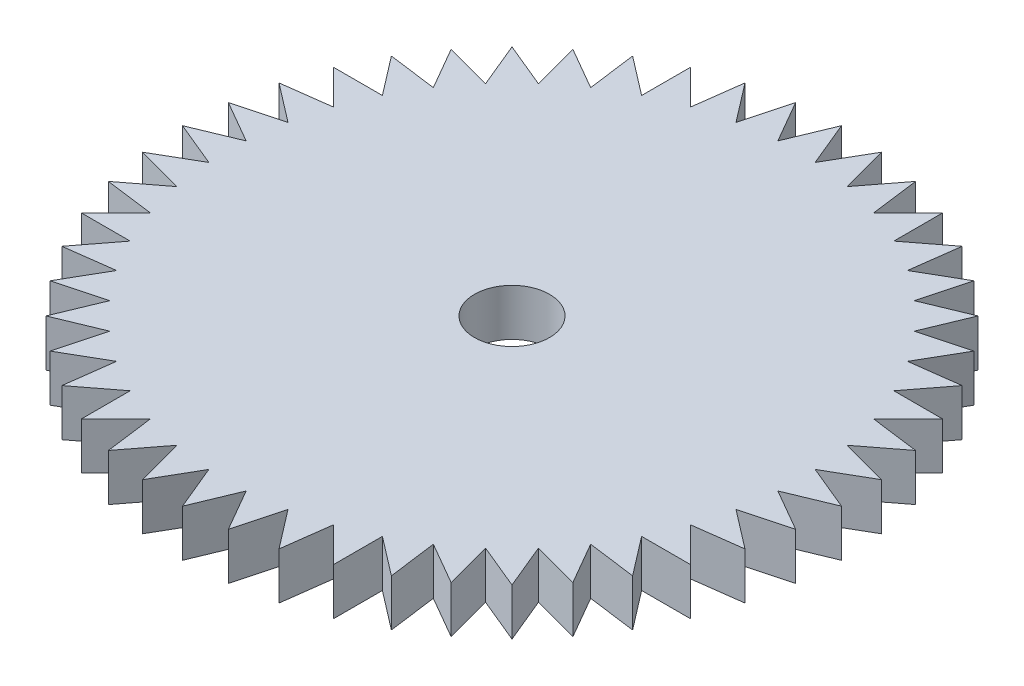
from build123d import *

# Parameters (mm, degrees)
BOSS_EXTRUDE1_DEPTH = 6.35
SKETCH3_R           = 5.08
CUT_EXTRUDE3_DEPTH  = 6.35


with BuildPart() as part:
    # Sketch2 → Boss-Extrude1 (new body)
    with BuildSketch(Plane(origin=(0, 0, 0), x_dir=(1, 0, 0), z_dir=(0, 1, 0))):
        Polygon((-17.07562385, 34.625939831), (-17.07562385, 41.224202684), (-12.409947442, 36.558526277), (-11.548701317, 43.100340077), (-7.531933394, 37.865586202), (-5.824177303, 44.2390187), (-2.525045876, 38.524755449), (0, 44.620755449), (2.525045876, 38.524755449), (5.824177303, 44.2390187), (7.531933394, 37.865586202), (11.548701317, 43.100340077), (12.409947442, 36.558526277), (17.07562385, 41.224202684), (17.07562385, 34.625939831), (22.310377724, 38.642707755), (21.449131599, 32.100893955), (27.16339485, 35.400025382), (25.45563876, 29.026592883), (31.55163876, 31.55163876), (29.026592883, 25.45563876), (35.400025382, 27.163394851), (32.100893955, 21.449131599), (38.642707755, 22.310377724), (34.625939831, 17.07562385), (41.224202684, 17.07562385), (36.558526277, 12.409947443), (43.100340077, 11.548701317), (37.865586202, 7.531933394), (44.2390187, 5.824177303), (38.524755449, 2.525045876), (44.620755449, 0), (38.524755449, -2.525045876), (44.2390187, -5.824177303), (37.865586202, -7.531933394), (43.100340077, -11.548701317), (36.558526277, -12.409947442), (41.224202684, -17.07562385), (34.625939831, -17.07562385), (38.642707755, -22.310377724), (32.100893955, -21.449131599), (35.400025382, -27.16339485), (29.026592883, -25.45563876), (31.55163876, -31.55163876), (25.45563876, -29.026592883), (27.163394851, -35.400025382), (21.449131599, -32.100893955), (22.310377724, -38.642707755), (17.07562385, -34.625939831), (17.07562385, -41.224202684), (12.409947443, -36.558526277), (11.548701317, -43.100340077), (7.531933394, -37.865586202), (5.824177303, -44.2390187), (2.525045876, -38.524755449), (0, -44.620755449), (-2.525045876, -38.524755449), (-5.824177303, -44.2390187), (-7.531933394, -37.865586202), (-11.548701317, -43.100340077), (-12.409947442, -36.558526277), (-17.07562385, -41.224202684), (-17.07562385, -34.625939831), (-22.310377724, -38.642707755), (-21.449131599, -32.100893955), (-27.16339485, -35.400025382), (-25.455638759, -29.026592883), (-31.551638759, -31.55163876), (-29.026592883, -25.45563876), (-35.400025382, -27.16339485), (-32.100893955, -21.449131599), (-38.642707755, -22.310377724), (-34.625939831, -17.07562385), (-41.224202684, -17.07562385), (-36.558526277, -12.409947442), (-43.100340077, -11.548701317), (-37.865586202, -7.531933394), (-44.2390187, -5.824177303), (-38.524755449, -2.525045876), (-44.620755449, 0), (-38.524755449, 2.525045876), (-44.2390187, 5.824177303), (-37.865586202, 7.531933394), (-43.100340077, 11.548701317), (-36.558526277, 12.409947442), (-41.224202684, 17.07562385), (-34.625939831, 17.07562385), (-38.642707755, 22.310377724), (-32.100893955, 21.449131599), (-35.400025382, 27.16339485), (-29.026592883, 25.45563876), (-31.55163876, 31.55163876), (-25.45563876, 29.026592883), (-27.16339485, 35.400025382), (-21.449131599, 32.100893955), (-22.310377724, 38.642707755), align=None)
    extrude(amount=BOSS_EXTRUDE1_DEPTH)

    # Sketch3 → Cut-Extrude3 (cut)
    with BuildSketch(Plane(origin=(0, 6.35, 0), x_dir=(1, 0, 0), z_dir=(0, 1, 0))):
        with Locations(Location((0, 0, 0), (0, 0, 270))):
            Circle(SKETCH3_R)
    extrude(amount=-CUT_EXTRUDE3_DEPTH, mode=Mode.SUBTRACT)


solid = part.part
